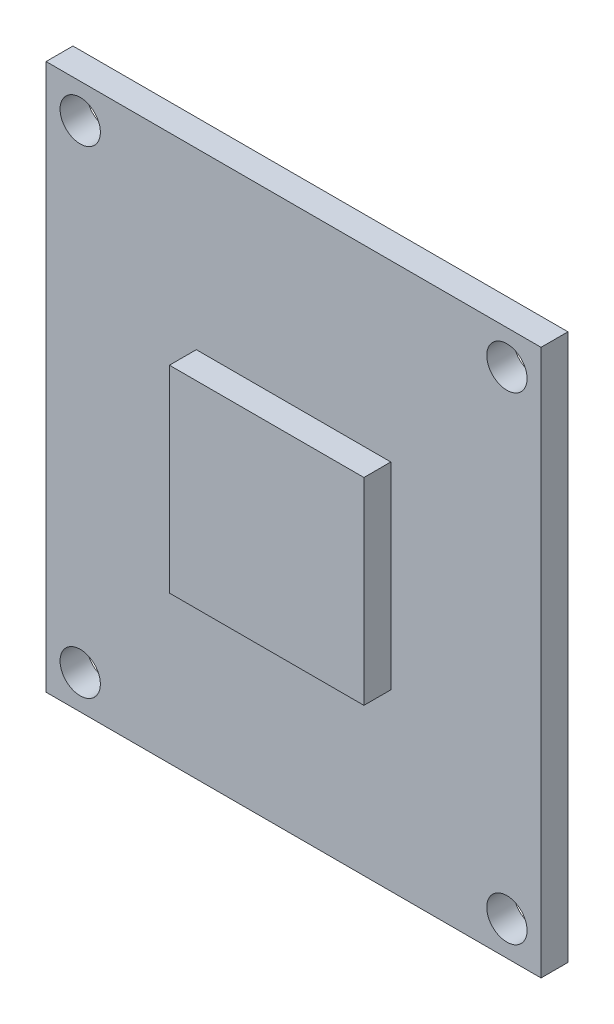
from build123d import *

# Parameters (mm, degrees)
SKETCH_1_W      = 36.83
SKETCH_1_H      = 40.64
SKETCH_1_R      = 1.5
EXTRUDE_1_DEPTH = 2
SKETCH_2_W      = 14.471058746
SKETCH_2_H      = 14.683868434
EXTRUDE_2_DEPTH = 2


with BuildPart() as part:
    # Эскиз1 → Бобышка-Вытянуть1 (new body)
    with BuildSketch(Plane.XY):
        Rectangle(SKETCH_1_W, SKETCH_1_H)
        with Locations((-15.875, 17.78)):
            Circle(SKETCH_1_R, mode=Mode.SUBTRACT)
        with Locations((15.875, 17.78)):
            Circle(SKETCH_1_R, mode=Mode.SUBTRACT)
        with Locations((-15.875, -17.78)):
            Circle(SKETCH_1_R, mode=Mode.SUBTRACT)
        with Locations((15.875, -17.78)):
            Circle(SKETCH_1_R, mode=Mode.SUBTRACT)
    extrude(amount=EXTRUDE_1_DEPTH)

    # Эскиз2 → Бобышка-Вытянуть2 (add)
    with BuildSketch(Plane.XY.offset(2)):
        Rectangle(SKETCH_2_W, SKETCH_2_H)
    extrude(amount=EXTRUDE_2_DEPTH)


solid = part.part
